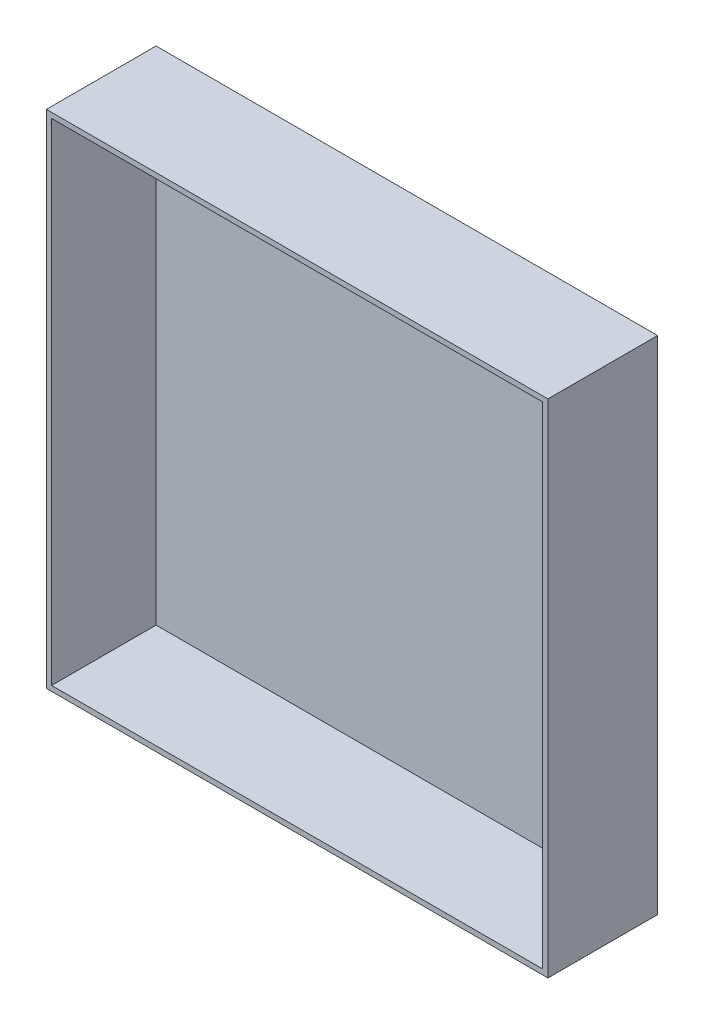
from build123d import *

# Parameters (mm, degrees)
SKETCH1_W           = 304.8
SKETCH1_H           = 304.8
BOSS_EXTRUDE1_DEPTH = 3.175
SKETCH2_W           = 298.45
SKETCH2_H           = 3.175
BOSS_EXTRUDE2_DEPTH = 63.5


with BuildPart() as part:
    # Sketch1 → Boss-Extrude1 (new body)
    with BuildSketch(Plane.XY):
        with Locations((152.4, 152.4)):
            Rectangle(SKETCH1_W, SKETCH1_H)
    extrude(amount=BOSS_EXTRUDE1_DEPTH)

    # Sketch2 → Boss-Extrude2 (add)
    with BuildSketch(Plane.XY.offset(3.175)):
        with Locations((152.4, 1.5875)):
            Rectangle(SKETCH2_W, SKETCH2_H)
        Polygon((3.175, 301.625), (0, 301.625), (0, 0), (3.175, 0), (3.175, 3.175), align=None)
        Polygon((304.8, 301.625), (304.8, 304.8), (0, 304.8), (0, 301.625), (3.175, 301.625), (301.625, 301.625), align=None)
        Polygon((304.8, 0), (304.8, 301.625), (301.625, 301.625), (301.625, 3.175), (301.625, 0), align=None)
    extrude(amount=BOSS_EXTRUDE2_DEPTH)


solid = part.part
